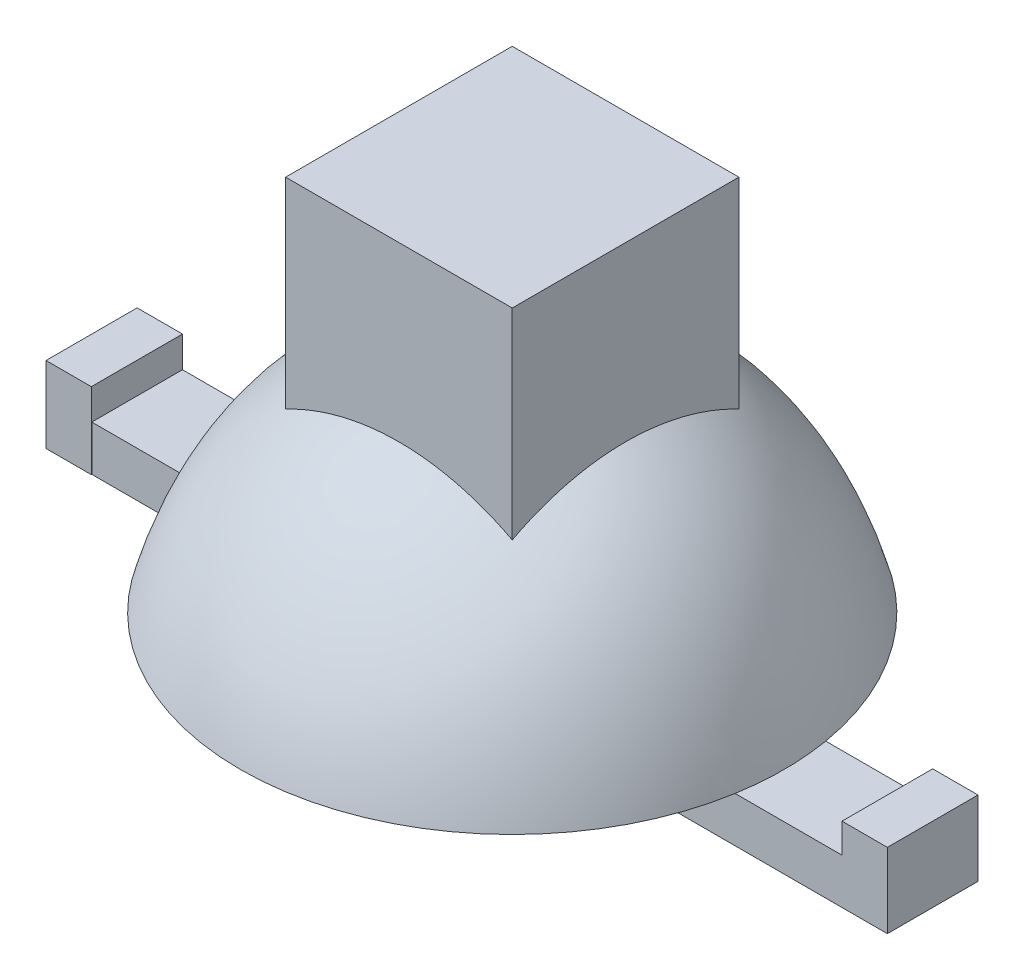
from build123d import *

# Parameters (mm, degrees)
EXTRUDE_1_DEPTH      = 1.5
EXTRUDE_1_DEPTH_BACK = 3
SKETCH_1_W           = 5
SKETCH_1_H           = 5
SKETCH_3_W           = 16.55
SKETCH_3_H           = 2
EXTRUDE_2_DEPTH      = 1
SKETCH_4_W           = 2.010575614
SKETCH_4_H           = 1.682122854
EXTRUDE_3_DEPTH      = 1
SKETCH_5_W           = 2
SKETCH_5_H           = 1.650542366
EXTRUDE_4_DEPTH      = 1


with BuildPart() as part:
    # 草图1 → 凸台-拉伸1 (new, two sides: drawn at the far end of the back side and taken through both)
    with BuildSketch(Plane(origin=(0, 0, 0), x_dir=(1, 0, 0), z_dir=(0, 1, 0)).offset(-EXTRUDE_1_DEPTH_BACK)):
        Rectangle(SKETCH_1_W, SKETCH_1_H)
    extrude(amount=EXTRUDE_1_DEPTH + EXTRUDE_1_DEPTH_BACK)

    # 草图2 → 旋转1 (revolve)
    with BuildSketch(Plane.XY):
        with BuildLine():
            Line((-6, -6.817094506), (0, -6.817094506))
            Line((0, -6.817094506), (0, -1.613202234))
            add(Edge.make_bspline(
                [(-6, -6.817094506), (-4.734338842, -2.184392528), (0, -1.613202234)],
                knots=[0, 0, 0, 1, 1, 1], degree=2))
        make_face()
    revolve(axis=Axis((0, -6.817094506, 0), (0, 1, 0)))

    # 草图3 → 凸台-拉伸2 (add)
    with BuildSketch(Plane.XZ.offset(6.817094506)):
        Rectangle(SKETCH_3_W, SKETCH_3_H)
    extrude(amount=EXTRUDE_2_DEPTH)

    # 草图4 → 凸台-拉伸3 (add)
    with BuildSketch(Plane.ZY.offset(8.275)):
        with Locations((0.005287807, -6.976033079)):
            Rectangle(SKETCH_4_W, SKETCH_4_H)
    extrude(amount=EXTRUDE_3_DEPTH)

    # 草图5 → 凸台-拉伸4 (add)
    with BuildSketch(Plane(origin=(8.275, 0, 0), x_dir=(0, 0, -1), z_dir=(1, 0, 0))):
        with Locations((0, -6.991823323)):
            Rectangle(SKETCH_5_W, SKETCH_5_H)
    extrude(amount=EXTRUDE_4_DEPTH)


solid = part.part
